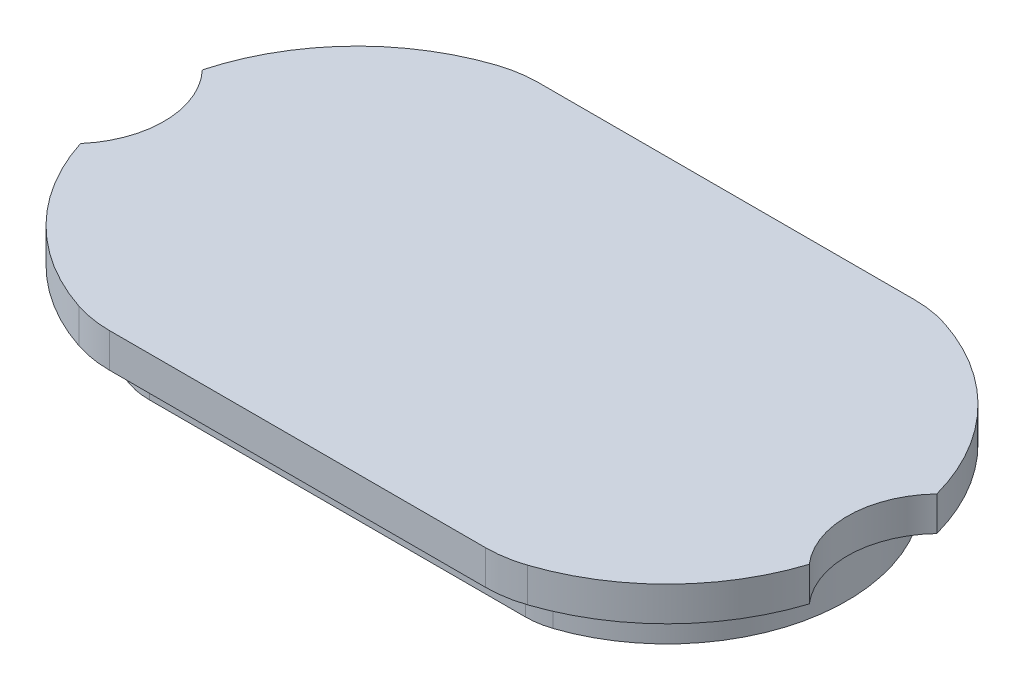
from build123d import *

# Parameters (mm, degrees)
BOSS_EXTRUDE1_DEPTH = 6
FILLET1_R           = 20
SKETCH4_W           = 3
SKETCH4_H           = 8
SKETCH6_R           = 16.245672788
CUT_EXTRUDE1_DEPTH  = 10


with BuildPart() as part:
    # Sketch1 → Boss-Extrude1 (new body)
    with BuildSketch(Plane(origin=(0, 0, 0), x_dir=(1, 0, 0), z_dir=(0, 1, 0))):
        with BuildLine():
            Line((34.540516942, 38.609131748), (-36.459483058, 38.609131748))
            ThreePointArc((-36.459483058, 38.609131748), (-66.459483058, 1.109131748), (-36.459483058, -36.390868252))
            Line((-36.459483058, -36.390868252), (34.540516942, -36.390868252))
            ThreePointArc((34.540516942, -36.390868252), (64.540516942, 1.109131748), (34.540516942, 38.609131748))
        make_face()
    extrude(amount=BOSS_EXTRUDE1_DEPTH)

    # Fillet1
    fillet1_edges = [part.edges().sort_by_distance(p)[0] for p in [
        (-36.459483058, 3, -38.609131748),
        (34.540516942, 3, -38.609131748),
        (34.540516942, 3, 36.390868252),
        (-36.459483058, 3, 36.390868252),
    ]]
    fillet(fillet1_edges, radius=FILLET1_R)

    # Sweep1: sweep along a path in Sketch3
    with BuildLine(Plane.XZ) as sweep1_path:
        Line((31.907446823, 29.390868252), (-33.82641294, 29.390868252))
        ThreePointArc((-33.82641294, 29.390868252), (-35.899239553, 29.224550102), (-37.919027907, 28.729851303))
        ThreePointArc((-37.919027907, 28.729851303), (-59.459483058, -1.109131748), (-37.919027907, -30.948114799))
        ThreePointArc((-37.919027907, -30.948114799), (-35.899239553, -31.442813598), (-33.82641294, -31.609131748))
        Line((-33.82641294, -31.609131748), (31.907446823, -31.609131748))
        ThreePointArc((31.907446823, -31.609131748), (33.980273437, -31.442813598), (36.000061791, -30.948114799))
        ThreePointArc((36.000061791, -30.948114799), (57.540516942, -1.109131748), (36.000061791, 28.729851303))
        ThreePointArc((36.000061791, 28.729851303), (33.980273437, 29.224550102), (31.907446823, 29.390868252))
    # Sketch4 → Sweep1 (sweep)
    with BuildSketch(Plane(origin=(31.907446823, 0, -31.609131748), x_dir=(0, 0, -1), z_dir=(1, 0, 0))):
        with Locations((-1.5, -4)):
            Rectangle(SKETCH4_W, SKETCH4_H)
    sweep(path=sweep1_path.line)

    # Sketch6 → Cut-Extrude1 (cut)
    with BuildSketch(Plane(origin=(0, 0, 0), x_dir=(1, 0, 0), z_dir=(0, 1, 0))):
        with Locations((75, 0)):
            Circle(SKETCH6_R)
        with Locations((-76.918966117, 0)):
            Circle(SKETCH6_R)
    extrude(amount=CUT_EXTRUDE1_DEPTH, mode=Mode.SUBTRACT)


solid = part.part
